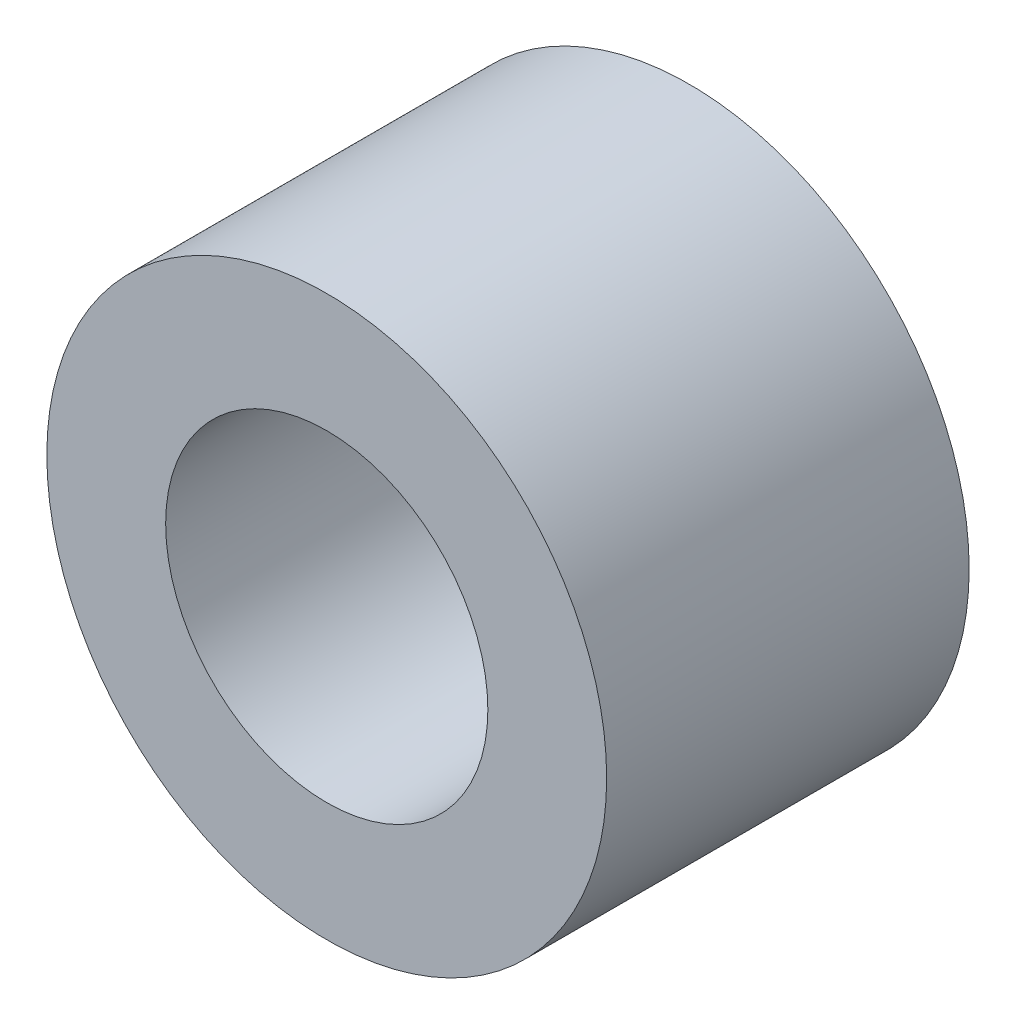
from build123d import *

# Parameters (mm, degrees)
SKETCH1_R           = 3.475
SKETCH1_R_2         = 2
BOSS_EXTRUDE1_DEPTH = 4.5


with BuildPart() as part:
    # Sketch1 → Boss-Extrude1 (new body)
    with BuildSketch(Plane.XY):
        Circle(SKETCH1_R)
        Circle(SKETCH1_R_2, mode=Mode.SUBTRACT)
    extrude(amount=BOSS_EXTRUDE1_DEPTH)


solid = part.part
